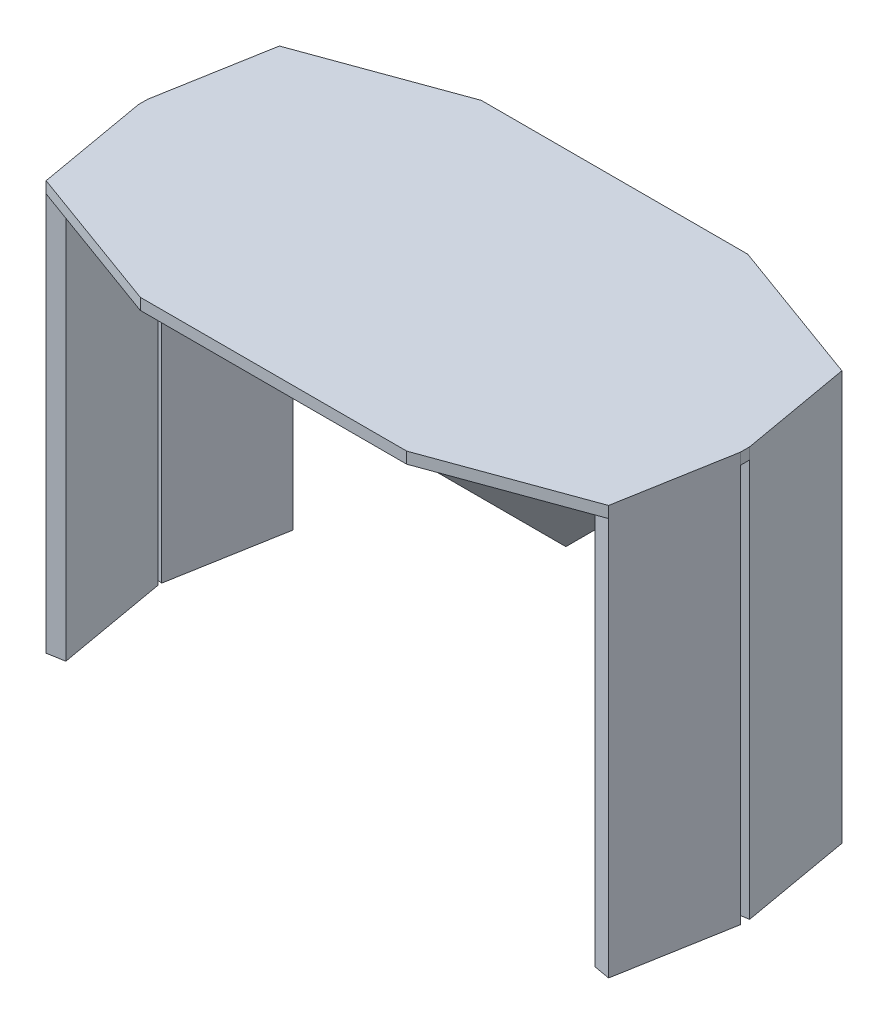
from build123d import *

# Parameters (mm, degrees)
BOSS_EXTRUDE1_DEPTH   = 100
CUT_EXTRUDE1_START    = -28.129025
CUT_EXTRUDE1_DEPTH    = 28.129025
BOSS_EXTRUDE2_DEPTH   = 70
BOSS_EXTRUDE2_2_DEPTH = 70
BOSS_EXTRUDE2_3_DEPTH = 70
BOSS_EXTRUDE2_4_DEPTH = 70
CUT_EXTRUDE2_START    = -20.520945
CUT_EXTRUDE2_DEPTH    = 38.356397
BOSS_EXTRUDE4_DEPTH   = 2


with BuildPart() as part:
    # Sketch2 → Boss-Extrude1 (new body)
    with BuildSketch(Plane(origin=(0, 0, 0), x_dir=(0, 0, -1), z_dir=(1, 0, 0))):
        Polygon((0, 0), (20, 28.562960135), (-20, 28.562960135), align=None)
    extrude(amount=BOSS_EXTRUDE1_DEPTH)

    # Sketch3 → Cut-Extrude1 (cut)
    with BuildSketch(Plane(origin=(0, 28.562960135, 0), x_dir=(1, 0, 0), z_dir=(0, 1, 0)).offset(CUT_EXTRUDE1_START)):
        Polygon((96.527036447, 20), (100, 0.30384494), (100, 20), align=None)
        Polygon((0, 0.30384494), (3.472963553, 20), (0, 20), align=None)
        Polygon((96.527036447, -20), (100, -0.30384494), (100, -20), align=None)
        Polygon((0, -0.30384494), (3.472963553, -20), (0, -20), align=None)
    extrude(amount=CUT_EXTRUDE1_DEPTH, mode=Mode.SUBTRACT)

    # Sketch7 → Cut-Extrude2 (cut)
    with BuildSketch(Plane.XY.offset(CUT_EXTRUDE2_START)):
        Polygon((0, 28.562960135), (28.562960135, 0), (0, 0), align=None)
        Polygon((100, 28.562960135), (100, 0), (71.437039865, 0), align=None)
    extrude(amount=CUT_EXTRUDE2_DEPTH, mode=Mode.SUBTRACT)



with BuildPart() as body_2:
    # Sketch4 → Boss-Extrude2 (new body)
    with BuildSketch(Plane(origin=(0, 28.562960135, 0), x_dir=(1, 0, 0), z_dir=(0, 1, 0))):
        Polygon((3.472963553, 20), (0.518540294, 20.520944533), (-2.954423259, 0.824789473), (0, 0.30384494), align=None)
    extrude(amount=-BOSS_EXTRUDE2_DEPTH)


with BuildPart() as body_3:
    # Sketch4 → Boss-Extrude2 2 (new body)
    with BuildSketch(Plane(origin=(0, 28.562960135, 0), x_dir=(1, 0, 0), z_dir=(0, 1, 0))):
        Polygon((96.527036447, 20), (100, 0.30384494), (102.954423259, 0.824789473), (99.481459706, 20.520944533), align=None)
    extrude(amount=-BOSS_EXTRUDE2_2_DEPTH)


with BuildPart() as body_4:
    # Sketch4 → Boss-Extrude2 3 (new body)
    with BuildSketch(Plane(origin=(0, 28.562960135, 0), x_dir=(1, 0, 0), z_dir=(0, 1, 0))):
        Polygon((96.527036447, -20), (99.481459706, -20.520944533), (102.954423259, -0.824789473), (100, -0.30384494), align=None)
    extrude(amount=-BOSS_EXTRUDE2_3_DEPTH)


with BuildPart() as body_5:
    # Sketch4 → Boss-Extrude2 4 (new body)
    with BuildSketch(Plane(origin=(0, 28.562960135, 0), x_dir=(1, 0, 0), z_dir=(0, 1, 0))):
        Polygon((3.472963553, -20), (0, -0.30384494), (-2.954423259, -0.824789473), (0.518540294, -20.520944533), align=None)
    extrude(amount=-BOSS_EXTRUDE2_4_DEPTH)


with BuildPart() as part_1:
    add(part.part)

    add(body_2.part)  # Boss-Extrude4 merges body 2

    add(body_3.part)  # Boss-Extrude4 merges body 3

    add(body_4.part)  # Boss-Extrude4 merges body 4

    add(body_5.part)  # Boss-Extrude4 merges body 5
    # Sketch8 → Boss-Extrude4 (add)
    with BuildSketch(Plane(origin=(0, 28.562960135, 0), x_dir=(1, 0, 0), z_dir=(0, 1, 0))):
        Polygon((0.518540294, 20.520944533), (26.562031148, 30), (73.437968852, 30), (99.481459706, 20.520944533), (102.954423259, 0.824789473), (102.954423259, -0.824789473), (99.481459706, -20.520944533), (73.437968852, -30), (26.562031148, -30), (0.518540294, -20.520944533), (-2.954423259, -0.824789473), (-2.954423259, 0.824789473), align=None)
    extrude(amount=BOSS_EXTRUDE4_DEPTH)


solid = part_1.part
